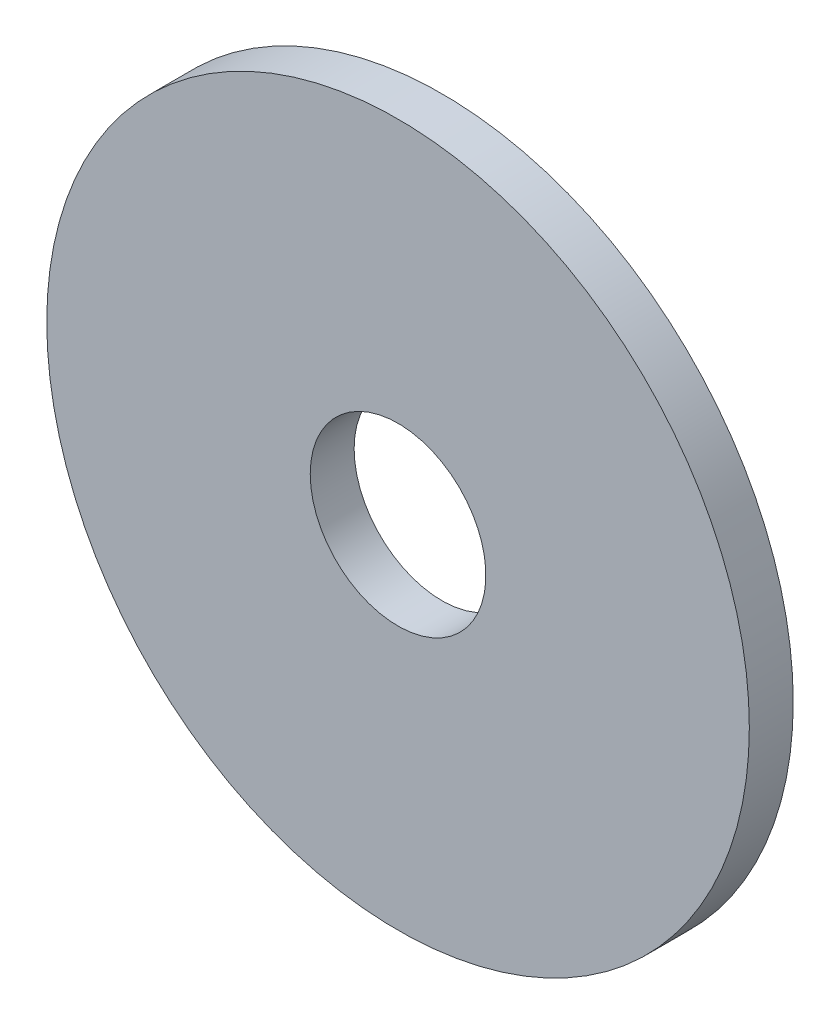
from build123d import *

# Parameters (mm, degrees)
SKETCH1_R           = 6.35
BOSS_EXTRUDE1_DEPTH = 0.79375
SKETCH2_R           = 1.5875
CUT_EXTRUDE1_DEPTH  = 0.79375


with BuildPart() as part:
    # Sketch1 → Boss-Extrude1 (new body)
    with BuildSketch(Plane.XY):
        with Locations((68.398246491, 3.214386977)):
            Circle(SKETCH1_R)
    extrude(amount=BOSS_EXTRUDE1_DEPTH)

    # Sketch2 → Cut-Extrude1 (cut)
    with BuildSketch(Plane(origin=(0, 0, 0), x_dir=(-1, 0, 0), z_dir=(0, 0, -1))):
        with Locations((-68.398246491, 3.214386977)):
            Circle(SKETCH2_R)
    extrude(amount=-CUT_EXTRUDE1_DEPTH, mode=Mode.SUBTRACT)


solid = part.part
